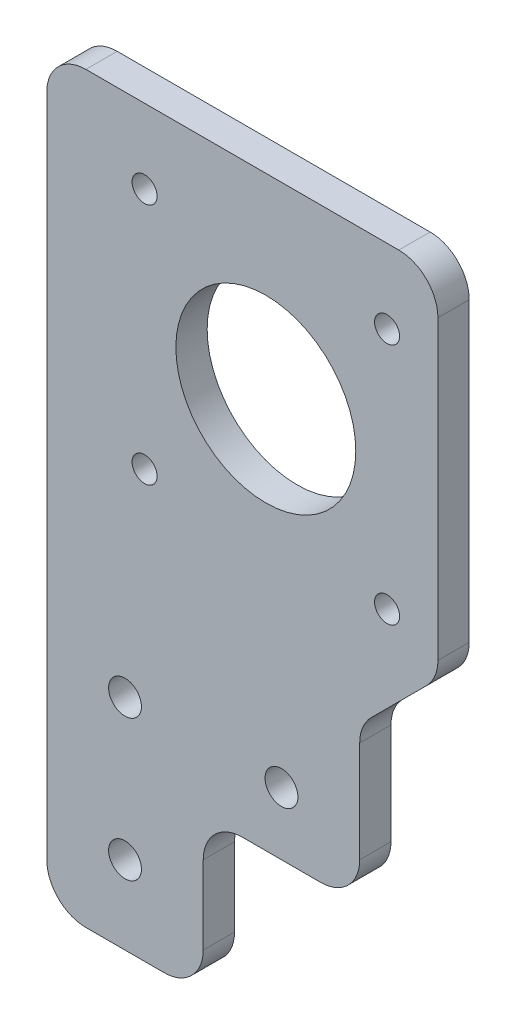
from build123d import *

# Parameters (mm, degrees)
MODEL_R         = 1.5999968
MODEL_R_2       = 2.0999958
MODEL_R_3       = 11.499977
EXTRUDE_1_DEPTH = 4


with BuildPart() as part:
    # Model → Бобышка-Вытянуть1 (new body)
    with BuildSketch(Plane.XY):
        with BuildLine():
            Line((274.028195208, 189.164211852), (274.028195208, 151.235355522))
            ThreePointArc((274.028195208, 151.235355522), (273.647593631, 149.321942187), (272.563732042, 147.699828687))
            Line((272.563732042, 147.699828687), (265.492678373, 140.628775017))
            ThreePointArc((265.492678373, 140.628775017), (264.408816784, 139.006661518), (264.028215208, 137.093248183))
            Line((264.028215208, 137.093248183), (264.028215208, 124.164341852))
            ThreePointArc((264.028215208, 124.164341852), (262.563752042, 120.628815017), (259.028225208, 119.164351852))
            Line((259.028225208, 119.164351852), (249.028245208, 119.164351852))
            ThreePointArc((249.028245208, 119.164351852), (245.492718373, 117.699888687), (244.028255208, 114.164361852))
            Line((244.028255208, 114.164361852), (244.028255208, 104.164381852))
            ThreePointArc((244.028255208, 104.164381852), (242.563792042, 100.628855017), (239.028265208, 99.164391852))
            Line((239.028265208, 99.164391852), (229.028285208, 99.164391852))
            ThreePointArc((229.028285208, 99.164391852), (225.492758373, 100.628855017), (224.028295208, 104.164381852))
            Line((224.028295208, 104.164381852), (224.028295208, 189.164211852))
            ThreePointArc((224.028295208, 189.164211852), (225.492758373, 192.699738687), (229.028285208, 194.164201852))
            Line((229.028285208, 194.164201852), (269.028205208, 194.164201852))
            ThreePointArc((269.028205208, 194.164201852), (272.563732043, 192.699738687), (274.028195208, 189.164211852))
        make_face()
        with Locations((267.528208208, 184.664220852)):
            Circle(MODEL_R, mode=Mode.SUBTRACT)
        with Locations((267.528208208, 153.664282852)):
            Circle(MODEL_R, mode=Mode.SUBTRACT)
        with Locations((236.528270208, 153.664282852)):
            Circle(MODEL_R, mode=Mode.SUBTRACT)
        with Locations((236.528270208, 184.664220852)):
            Circle(MODEL_R, mode=Mode.SUBTRACT)
        with Locations((254.028235208, 127.164335852)):
            Circle(MODEL_R_2, mode=Mode.SUBTRACT)
        with Locations((234.028275208, 127.164335852)):
            Circle(MODEL_R_2, mode=Mode.SUBTRACT)
        with Locations((234.028275208, 109.164371852)):
            Circle(MODEL_R_2, mode=Mode.SUBTRACT)
        with Locations((252.028239208, 169.164251852)):
            Circle(MODEL_R_3, mode=Mode.SUBTRACT)
    extrude(amount=EXTRUDE_1_DEPTH)


solid = part.part
